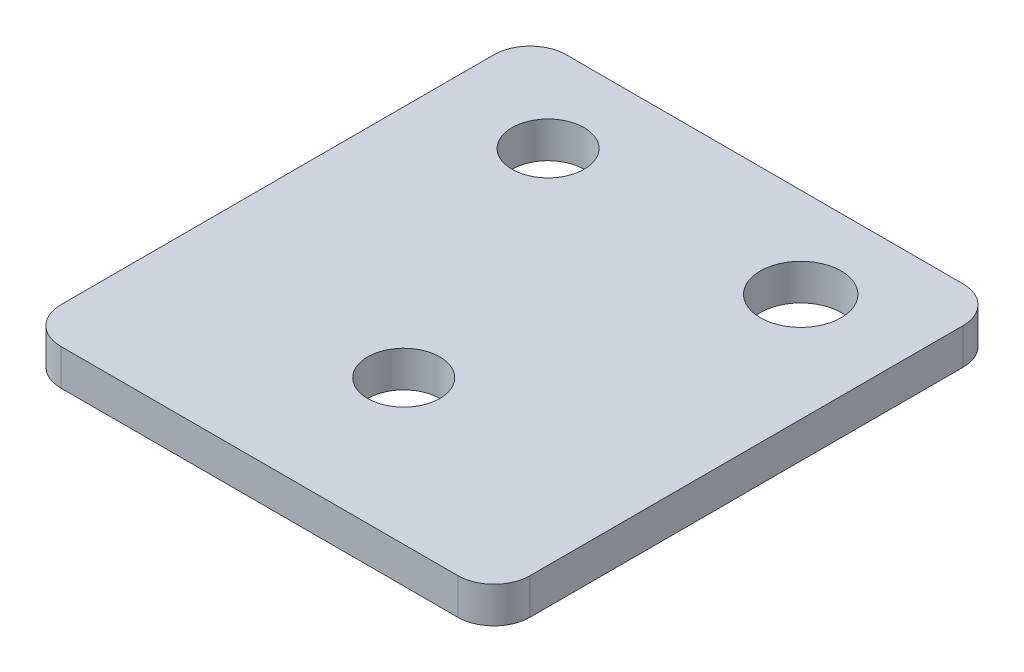
from build123d import *

# Parameters (mm, degrees)
SKETCH1_W           = 41.275
SKETCH1_H           = 44.45
BOSS_EXTRUDE1_DEPTH = 3.175
FILLET1_R           = 3.175
SKETCH2_R           = 3.175
SKETCH2_R_2         = 3.561696706
CUT_EXTRUDE1_DEPTH  = 61.741326541


with BuildPart() as part:
    # Sketch1 → Boss-Extrude1 (new body)
    with BuildSketch(Plane(origin=(0, 0, 0), x_dir=(1, 0, 0), z_dir=(0, 1, 0))):
        with Locations((20.6375, 22.225)):
            Rectangle(SKETCH1_W, SKETCH1_H)
    extrude(amount=BOSS_EXTRUDE1_DEPTH)

    # Fillet1
    fillet1_edges = [part.edges().sort_by_distance(p)[0] for p in [
        (0, 1.5875, -44.45),
        (41.275, 1.5875, -44.45),
        (41.275, 1.5875, 0),
        (0, 1.5875, 0),
    ]]
    fillet(fillet1_edges, radius=FILLET1_R)

    # Sketch2 → Cut-Extrude1 (cut, through all)
    with BuildSketch(Plane(origin=(0, 3.175, 0), x_dir=(1, 0, 0), z_dir=(0, 1, 0))):
        with Locations(Location((9.525, 36.5125, 0), (0, 0, 270))):
            Circle(SKETCH2_R)
        with Locations(Location((31.75, 36.5125, 0), (0, 0, 270))):
            Circle(SKETCH2_R_2)
        with Locations(Location((20.6375, 12.7, 0), (0, 0, 270))):
            Circle(SKETCH2_R)
    extrude(amount=-CUT_EXTRUDE1_DEPTH, mode=Mode.SUBTRACT)


solid = part.part
